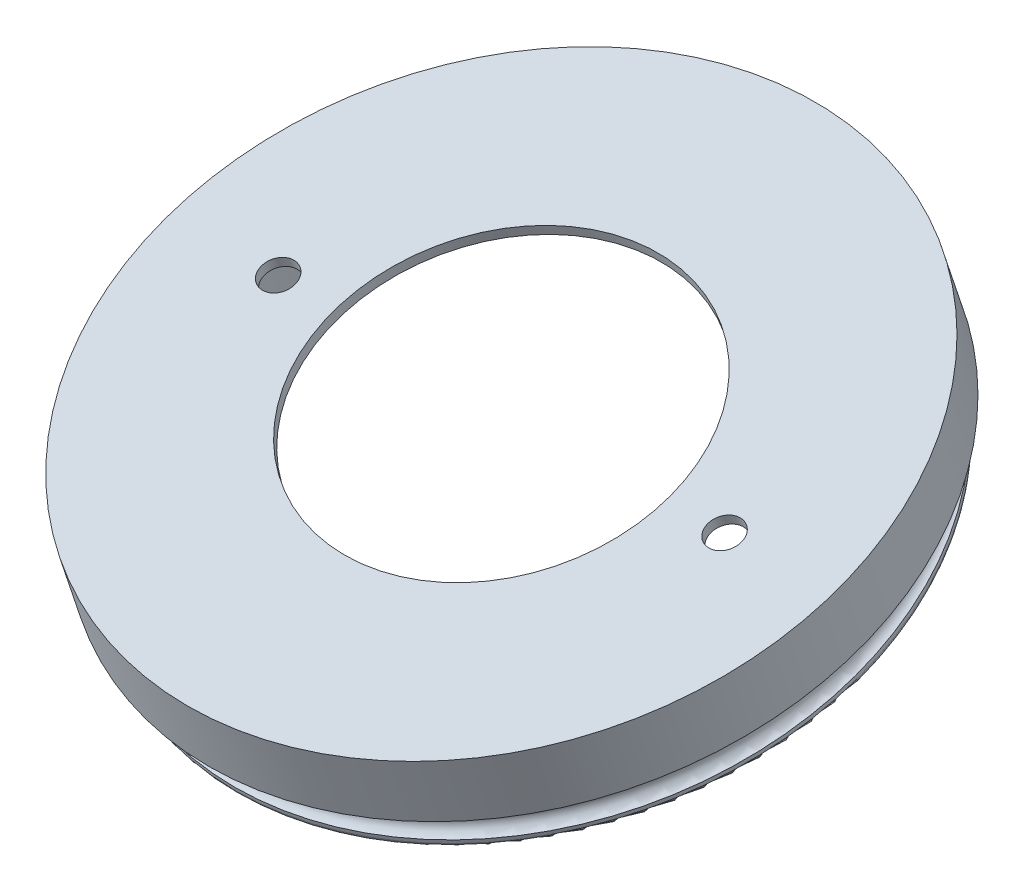
from build123d import *

# Parameters (mm, degrees)
CONG_3_R           = 0.6
CONG_4_R           = 0.6
ESQUISSE4_R        = 38.6
ESQUISSE4_R_2      = 20
ESQUISSE4_R_3      = 2
BOSS_EXTRU_1_DEPTH = 1.2
CONG_5_R           = 2


with BuildPart() as part:
    # Esquisse2 → Révolution2 (revolve)
    with BuildSketch(Plane(origin=(0, 0, 0), x_dir=(0, 0, -1), z_dir=(1, 0, 0)), mode=Mode.PRIVATE) as r_volution2_sk:
        with BuildLine():
            Line((51.393171508, -33.133195588), (51.735071882, -34.155028094))
            Line((51.735071882, -34.155028094), (49.364262744, -34.948289735))
            Line((49.364262744, -34.948289735), (46.825825492, -27.361700493))
            Line((46.825825492, -27.361700493), (49.553163532, -26.44914595))
            Line((49.553163532, -26.44914595), (47.7769073, -21.140475659))
            Line((47.7769073, -21.140475659), (49.104560417, -20.69624914))
            Line((49.104560417, -20.69624914), (51.642347825, -28.280896204))
            Line((51.642347825, -28.280896204), (50.409527073, -28.693392257))
            Line((50.409527073, -28.693392257), (50.917214523, -30.210710105))
            ThreePointArc((50.917214523, -30.210710105), (49.912676958, -31.874309437), (51.393171508, -33.133195588))
        make_face()
    revolve(r_volution2_sk.sketch.rotate(Axis((0, 0, 0), (0, -0.9483236552061978, -0.3173046564050968)), 180), axis=Axis((0, 0, 0), (0, -0.9483236552061978, -0.3173046564050968)))

    # Congé3
    cong_3_edges = [part.edges().sort_by_distance(p)[0] for p in [
        (0, -30.210710105, -50.917214523),
    ]]
    fillet(cong_3_edges, radius=CONG_3_R)

    # Congé4
    cong_4_edges = [part.edges().sort_by_distance(p)[0] for p in [
        (0, -34.155028094, -51.735071882),
    ]]
    fillet(cong_4_edges, radius=CONG_4_R)

    # Esquisse4 → Boss.-Extru.1 (add)
    with BuildSketch(Plane(origin=(0, -33.388435396, -11.171614209), x_dir=(1, 0, 0), z_dir=(0, 0.9483236552061979, 0.31730465640509686))):
        with Locations(Location((0, 0, 0), (0, 0, 270))):
            Circle(ESQUISSE4_R)
        with Locations(Location((0, 0, 0), (0, 0, 270))):
            Circle(ESQUISSE4_R_2, mode=Mode.SUBTRACT)
        with Locations(Location((-27, 0, 0), (0, 0, 270))):
            Circle(ESQUISSE4_R_3, mode=Mode.SUBTRACT)
        with Locations(Location((27, 0, 0), (0, 0, 270))):
            Circle(ESQUISSE4_R_3, mode=Mode.SUBTRACT)
    extrude(amount=-BOSS_EXTRU_1_DEPTH)

    # Congé5
    cong_5_edges = [part.edges().sort_by_distance(p)[0] for p in [
        (0, -22.278464045, -48.157672888),
        (0, -26.44914595, -49.553163532),
    ]]
    fillet(cong_5_edges, radius=CONG_5_R)


solid = part.part
